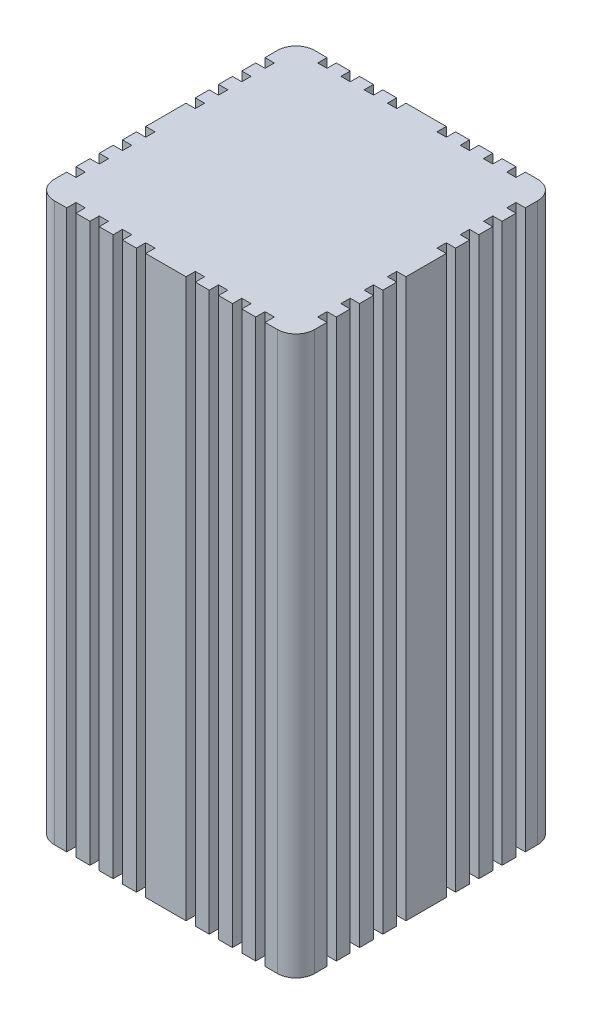
from build123d import *

# Parameters (mm, degrees)
BOSS_EXTRU_1_DEPTH = 90
ESQUISSE2_R        = 7
ESQUISSE2_R_2      = 4
BOSS_EXTRU_2_DEPTH = 6
CONG_1_R           = 1


with BuildPart() as part:
    # Esquisse1 → Boss.-Extru.1 (new body)
    with BuildSketch(Plane(origin=(0, 0, 0), x_dir=(1, 0, 0), z_dir=(0, 1, 0))):
        with BuildLine():
            Line((-19.909227763, -17.432297172), (-21.409227763, -17.432297172))
            Line((-21.409227763, -17.432297172), (-21.409227763, -19.432297172))
            ThreePointArc((-21.409227763, -19.432297172), (-20.530548107, -21.553617516), (-18.409227763, -22.432297172))
            Line((-18.409227763, -22.432297172), (-16.409227763, -22.432297172))
            Line((-16.409227763, -22.432297172), (-16.409227763, -20.932297172))
            Line((-16.409227763, -20.932297172), (-14.909227763, -20.932297172))
            Line((-14.909227763, -20.932297172), (-14.909227763, -22.432297172))
            Line((-14.909227763, -22.432297172), (-12.659227763, -22.432297172))
            Line((-12.659227763, -22.432297172), (-12.659227763, -20.932297172))
            Line((-12.659227763, -20.932297172), (-11.159227763, -20.932297172))
            Line((-11.159227763, -20.932297172), (-11.159227763, -22.432297172))
            Line((-11.159227763, -22.432297172), (-8.909227763, -22.432297172))
            Line((-8.909227763, -22.432297172), (-8.909227763, -20.932297172))
            Line((-8.909227763, -20.932297172), (-7.409227763, -20.932297172))
            Line((-7.409227763, -20.932297172), (-7.409227763, -22.432297172))
            Line((-7.409227763, -22.432297172), (-5.159227763, -22.432297172))
            Line((-5.159227763, -22.432297172), (-5.159227763, -20.932297172))
            Line((-5.159227763, -20.932297172), (-3.659227763, -20.932297172))
            Line((-3.659227763, -20.932297172), (-3.659227763, -22.432297172))
            Line((-3.659227763, -22.432297172), (2.840772237, -22.432297172))
            Line((2.840772237, -22.432297172), (2.840772237, -20.932297172))
            Line((2.840772237, -20.932297172), (4.340772237, -20.932297172))
            Line((4.340772237, -20.932297172), (4.340772237, -22.432297172))
            Line((4.340772237, -22.432297172), (6.590772237, -22.432297172))
            Line((6.590772237, -22.432297172), (6.590772237, -20.932297172))
            Line((6.590772237, -20.932297172), (8.090772237, -20.932297172))
            Line((8.090772237, -20.932297172), (8.090772237, -22.432297172))
            Line((8.090772237, -22.432297172), (10.340772237, -22.432297172))
            Line((10.340772237, -22.432297172), (10.340772237, -20.932297172))
            Line((10.340772237, -20.932297172), (11.840772237, -20.932297172))
            Line((11.840772237, -20.932297172), (11.840772237, -22.432297172))
            Line((11.840772237, -22.432297172), (14.090772237, -22.432297172))
            Line((14.090772237, -22.432297172), (14.090772237, -20.932297172))
            Line((14.090772237, -20.932297172), (15.590772237, -20.932297172))
            Line((15.590772237, -20.932297172), (15.590772237, -22.432297172))
            Line((15.590772237, -22.432297172), (17.590772237, -22.432297172))
            ThreePointArc((17.590772237, -22.432297172), (19.71209258, -21.553617516), (20.590772237, -19.432297172))
            Line((20.590772237, -19.432297172), (20.590772237, -17.432297172))
            Line((20.590772237, -17.432297172), (19.090772237, -17.432297172))
            Line((19.090772237, -17.432297172), (19.090772237, -15.932297172))
            Line((19.090772237, -15.932297172), (20.590772237, -15.932297172))
            Line((20.590772237, -15.932297172), (20.590772237, -13.682297172))
            Line((20.590772237, -13.682297172), (19.090772237, -13.682297172))
            Line((19.090772237, -13.682297172), (19.090772237, -12.182297172))
            Line((19.090772237, -12.182297172), (20.590772237, -12.182297172))
            Line((20.590772237, -12.182297172), (20.590772237, -9.932297172))
            Line((20.590772237, -9.932297172), (19.090772237, -9.932297172))
            Line((19.090772237, -9.932297172), (19.090772237, -8.432297172))
            Line((19.090772237, -8.432297172), (20.590772237, -8.432297172))
            Line((20.590772237, -8.432297172), (20.590772237, -6.182297172))
            Line((20.590772237, -6.182297172), (19.090772237, -6.182297172))
            Line((19.090772237, -6.182297172), (19.090772237, -4.682297172))
            Line((19.090772237, -4.682297172), (20.590772237, -4.682297172))
            Line((20.590772237, -4.682297172), (20.590772237, 1.817702828))
            Line((20.590772237, 1.817702828), (19.090772237, 1.817702828))
            Line((19.090772237, 1.817702828), (19.090772237, 3.317702828))
            Line((19.090772237, 3.317702828), (20.590772237, 3.317702828))
            Line((20.590772237, 3.317702828), (20.590772237, 5.567702828))
            Line((20.590772237, 5.567702828), (19.090772237, 5.567702828))
            Line((19.090772237, 5.567702828), (19.090772237, 7.067702828))
            Line((19.090772237, 7.067702828), (20.590772237, 7.067702828))
            Line((20.590772237, 7.067702828), (20.590772237, 9.317702828))
            Line((20.590772237, 9.317702828), (19.090772237, 9.317702828))
            Line((19.090772237, 9.317702828), (19.090772237, 10.817702828))
            Line((19.090772237, 10.817702828), (20.590772237, 10.817702828))
            Line((20.590772237, 10.817702828), (20.590772237, 13.067702828))
            Line((20.590772237, 13.067702828), (19.090772237, 13.067702828))
            Line((19.090772237, 13.067702828), (19.090772237, 14.567702828))
            Line((19.090772237, 14.567702828), (20.590772237, 14.567702828))
            Line((20.590772237, 14.567702828), (20.590772237, 16.567702828))
            ThreePointArc((20.590772237, 16.567702828), (19.71209258, 18.689023171), (17.590772237, 19.567702828))
            Line((17.590772237, 19.567702828), (15.590772237, 19.567702828))
            Line((15.590772237, 19.567702828), (15.590772237, 18.067702828))
            Line((15.590772237, 18.067702828), (14.090772237, 18.067702828))
            Line((14.090772237, 18.067702828), (14.090772237, 19.567702828))
            Line((14.090772237, 19.567702828), (11.840772237, 19.567702828))
            Line((11.840772237, 19.567702828), (11.840772237, 18.067702828))
            Line((11.840772237, 18.067702828), (10.340772237, 18.067702828))
            Line((10.340772237, 18.067702828), (10.340772237, 19.567702828))
            Line((10.340772237, 19.567702828), (8.090772237, 19.567702828))
            Line((8.090772237, 19.567702828), (8.090772237, 18.067702828))
            Line((8.090772237, 18.067702828), (6.590772237, 18.067702828))
            Line((6.590772237, 18.067702828), (6.590772237, 19.567702828))
            Line((6.590772237, 19.567702828), (4.340772237, 19.567702828))
            Line((4.340772237, 19.567702828), (4.340772237, 18.067702828))
            Line((4.340772237, 18.067702828), (2.840772237, 18.067702828))
            Line((2.840772237, 18.067702828), (2.840772237, 19.567702828))
            Line((2.840772237, 19.567702828), (-3.659227763, 19.567702828))
            Line((-3.659227763, 19.567702828), (-3.659227763, 18.067702828))
            Line((-3.659227763, 18.067702828), (-5.159227763, 18.067702828))
            Line((-5.159227763, 18.067702828), (-5.159227763, 19.567702828))
            Line((-5.159227763, 19.567702828), (-7.409227763, 19.567702828))
            Line((-7.409227763, 19.567702828), (-7.409227763, 18.067702828))
            Line((-7.409227763, 18.067702828), (-8.909227763, 18.067702828))
            Line((-8.909227763, 18.067702828), (-8.909227763, 19.567702828))
            Line((-8.909227763, 19.567702828), (-11.159227763, 19.567702828))
            Line((-11.159227763, 19.567702828), (-11.159227763, 18.067702828))
            Line((-11.159227763, 18.067702828), (-12.659227763, 18.067702828))
            Line((-12.659227763, 18.067702828), (-12.659227763, 19.567702828))
            Line((-12.659227763, 19.567702828), (-14.909227763, 19.567702828))
            Line((-14.909227763, 19.567702828), (-14.909227763, 18.067702828))
            Line((-14.909227763, 18.067702828), (-16.409227763, 18.067702828))
            Line((-16.409227763, 18.067702828), (-16.409227763, 19.567702828))
            Line((-16.409227763, 19.567702828), (-18.409227763, 19.567702828))
            ThreePointArc((-18.409227763, 19.567702828), (-20.530548107, 18.689023171), (-21.409227763, 16.567702828))
            Line((-21.409227763, 16.567702828), (-21.409227763, 14.567702828))
            Line((-21.409227763, 14.567702828), (-19.909227763, 14.567702828))
            Line((-19.909227763, 14.567702828), (-19.909227763, 13.067702828))
            Line((-19.909227763, 13.067702828), (-21.409227763, 13.067702828))
            Line((-21.409227763, 13.067702828), (-21.409227763, 10.817702828))
            Line((-21.409227763, 10.817702828), (-19.909227763, 10.817702828))
            Line((-19.909227763, 10.817702828), (-19.909227763, 9.317702828))
            Line((-19.909227763, 9.317702828), (-21.409227763, 9.317702828))
            Line((-21.409227763, 9.317702828), (-21.409227763, 7.067702828))
            Line((-21.409227763, 7.067702828), (-19.909227763, 7.067702828))
            Line((-19.909227763, 7.067702828), (-19.909227763, 5.567702828))
            Line((-19.909227763, 5.567702828), (-21.409227763, 5.567702828))
            Line((-21.409227763, 5.567702828), (-21.409227763, 3.317702828))
            Line((-21.409227763, 3.317702828), (-19.909227763, 3.317702828))
            Line((-19.909227763, 3.317702828), (-19.909227763, 1.817702828))
            Line((-19.909227763, 1.817702828), (-21.409227763, 1.817702828))
            Line((-21.409227763, 1.817702828), (-21.409227763, -4.682297172))
            Line((-21.409227763, -4.682297172), (-19.909227763, -4.682297172))
            Line((-19.909227763, -4.682297172), (-19.909227763, -6.182297172))
            Line((-19.909227763, -6.182297172), (-21.409227763, -6.182297172))
            Line((-21.409227763, -6.182297172), (-21.409227763, -8.432297172))
            Line((-21.409227763, -8.432297172), (-19.909227763, -8.432297172))
            Line((-19.909227763, -8.432297172), (-19.909227763, -9.932297172))
            Line((-19.909227763, -9.932297172), (-21.409227763, -9.932297172))
            Line((-21.409227763, -9.932297172), (-21.409227763, -12.182297172))
            Line((-21.409227763, -12.182297172), (-19.909227763, -12.182297172))
            Line((-19.909227763, -12.182297172), (-19.909227763, -13.682297172))
            Line((-19.909227763, -13.682297172), (-21.409227763, -13.682297172))
            Line((-21.409227763, -13.682297172), (-21.409227763, -15.932297172))
            Line((-21.409227763, -15.932297172), (-19.909227763, -15.932297172))
            Line((-19.909227763, -15.932297172), (-19.909227763, -17.432297172))
        make_face()
    extrude(amount=BOSS_EXTRU_1_DEPTH)

    # Esquisse2 → Boss.-Extru.2 (add)
    with BuildSketch(Plane.XZ):
        with Locations(Location((0, 0, 0), (0, 0, 90))):
            Circle(ESQUISSE2_R)
        with Locations(Location((0, 0, 0), (0, 0, 270))):
            Circle(ESQUISSE2_R_2, mode=Mode.SUBTRACT)
    extrude(amount=BOSS_EXTRU_2_DEPTH)

    # Congé1
    cong_1_edges = [part.edges().sort_by_distance(p)[0] for p in [
        (0, -6, -7),
    ]]
    fillet(cong_1_edges, radius=CONG_1_R)


solid = part.part
